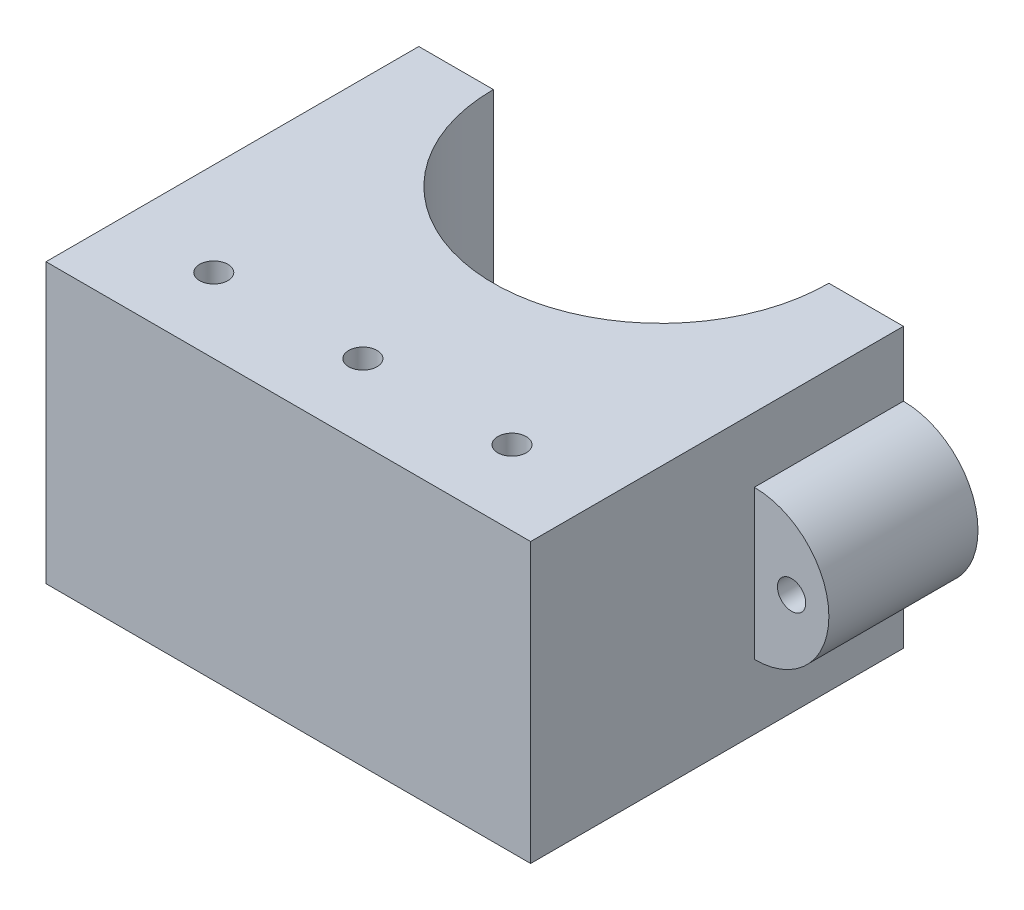
from build123d import *

# Parameters (mm, degrees)
BOSS_EXTRUDE1_DEPTH     = 47.498
CUT_EXTRUDE3_DEPTH      = 115.467517244
CUT_EXTRUDE3_DEPTH_BACK = 115.467517244
SKETCH2_R               = 2.413
SKETCH2_4_R             = 2.413
CUT_EXTRUDE4_DEPTH      = 115.467517244
SKETCH6_R               = 12.7
BOSS_EXTRUDE5_DEPTH     = 25.4
SKETCH6_6_R             = 12.7
BOSS_EXTRUDE6_DEPTH     = 25.4
SKETCH8_R               = 2.413
CUT_EXTRUDE5_DEPTH      = 25.4
SKETCH9_R               = 2.413
CUT_EXTRUDE6_DEPTH      = 25.4


with BuildPart() as part:
    # Sketch1 → Boss-Extrude1 (new body)
    with BuildSketch(Plane(origin=(0, 0, 0), x_dir=(1, 0, 0), z_dir=(0, 1, 0))):
        with BuildLine():
            Line((0, 0), (0, 63.5))
            Line((0, 63.5), (12.7, 63.5))
            ThreePointArc((12.7, 63.5), (41.275, 34.925), (69.85, 63.5))
            Line((69.85, 63.5), (82.55, 63.5))
            Line((82.55, 63.5), (82.55, 0))
            Line((82.55, 0), (0, 0))
        make_face()
    extrude(amount=BOSS_EXTRUDE1_DEPTH)

    # Sketch2 → Cut-Extrude3 (cut, two sides: drawn at the far end of the back side and taken through both)
    with BuildSketch(Plane(origin=(0, 47.498, 0), x_dir=(1, 0, 0), z_dir=(0, 1, 0)).offset(-CUT_EXTRUDE3_DEPTH_BACK)):
        with Locations((15.875, 12.7)):
            Circle(SKETCH2_R)
    extrude(amount=CUT_EXTRUDE3_DEPTH + CUT_EXTRUDE3_DEPTH_BACK, mode=Mode.SUBTRACT)

    # Sketch2<4> → Cut-Extrude4 (cut, through all)
    with BuildSketch(Plane(origin=(0, 47.498, 0), x_dir=(1, 0, 0), z_dir=(0, 1, 0))):
        with Locations((15.875, 12.7)):
            Circle(SKETCH2_4_R)
        with Locations((41.275, 12.7)):
            Circle(SKETCH2_4_R)
        with Locations((66.675, 12.7)):
            Circle(SKETCH2_4_R)
    extrude(amount=-CUT_EXTRUDE4_DEPTH, mode=Mode.SUBTRACT)

    # Sketch6 → Boss-Extrude5 (add)
    with BuildSketch(Plane(origin=(0, 0, -63.5), x_dir=(-1, 0, 0), z_dir=(0, 0, -1))):
        with Locations((-82.55, 23.749)):
            Circle(SKETCH6_R)
    extrude(amount=-BOSS_EXTRUDE5_DEPTH)

    # Sketch6<6> → Boss-Extrude6 (add)
    with BuildSketch(Plane(origin=(0, 0, -63.5), x_dir=(-1, 0, 0), z_dir=(0, 0, -1))):
        with Locations((0, 24.290625464)):
            Circle(SKETCH6_6_R)
        with Locations((-82.55, 23.749)):
            Circle(SKETCH6_6_R)
    extrude(amount=-BOSS_EXTRUDE6_DEPTH)

    # Sketch8 → Cut-Extrude5 (cut)
    with BuildSketch(Plane(origin=(0, 0, -63.5), x_dir=(-1, 0, 0), z_dir=(0, 0, -1))):
        with Locations((-88.9, 23.749)):
            Circle(SKETCH8_R)
    extrude(amount=-CUT_EXTRUDE5_DEPTH, mode=Mode.SUBTRACT)

    # Sketch9 → Cut-Extrude6 (cut)
    with BuildSketch(Plane(origin=(0, 0, -63.5), x_dir=(-1, 0, 0), z_dir=(0, 0, -1))):
        with Locations((6.296749676, 24.139451287)):
            Circle(SKETCH9_R)
    extrude(amount=-CUT_EXTRUDE6_DEPTH, mode=Mode.SUBTRACT)


solid = part.part
